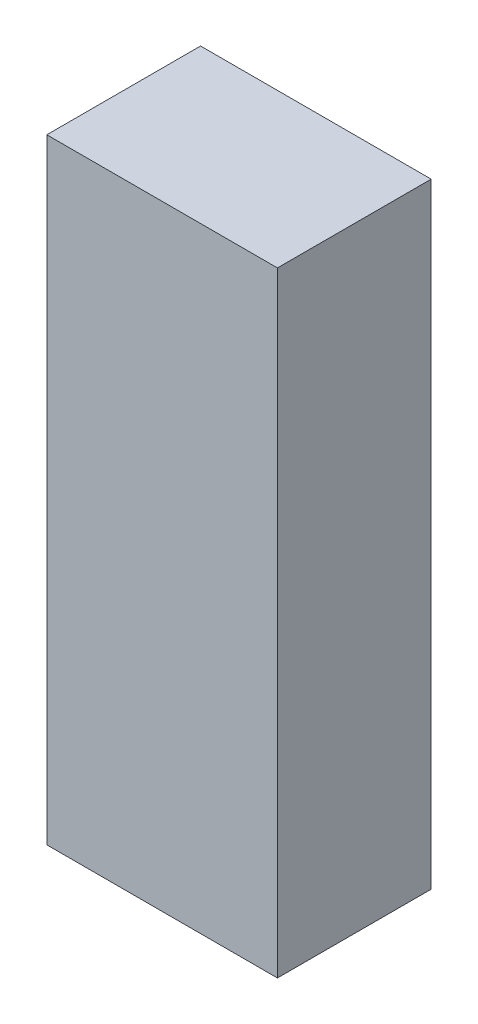
from build123d import *

# Parameters (mm, degrees)
SKETCH1_W           = 15
SKETCH1_H           = 40
BOSS_EXTRUDE1_DEPTH = 10


with BuildPart() as part:
    # Sketch1 → Boss-Extrude1 (new body)
    with BuildSketch(Plane.XY):
        with Locations((7.5, 20)):
            Rectangle(SKETCH1_W, SKETCH1_H)
    extrude(amount=BOSS_EXTRUDE1_DEPTH)


solid = part.part
